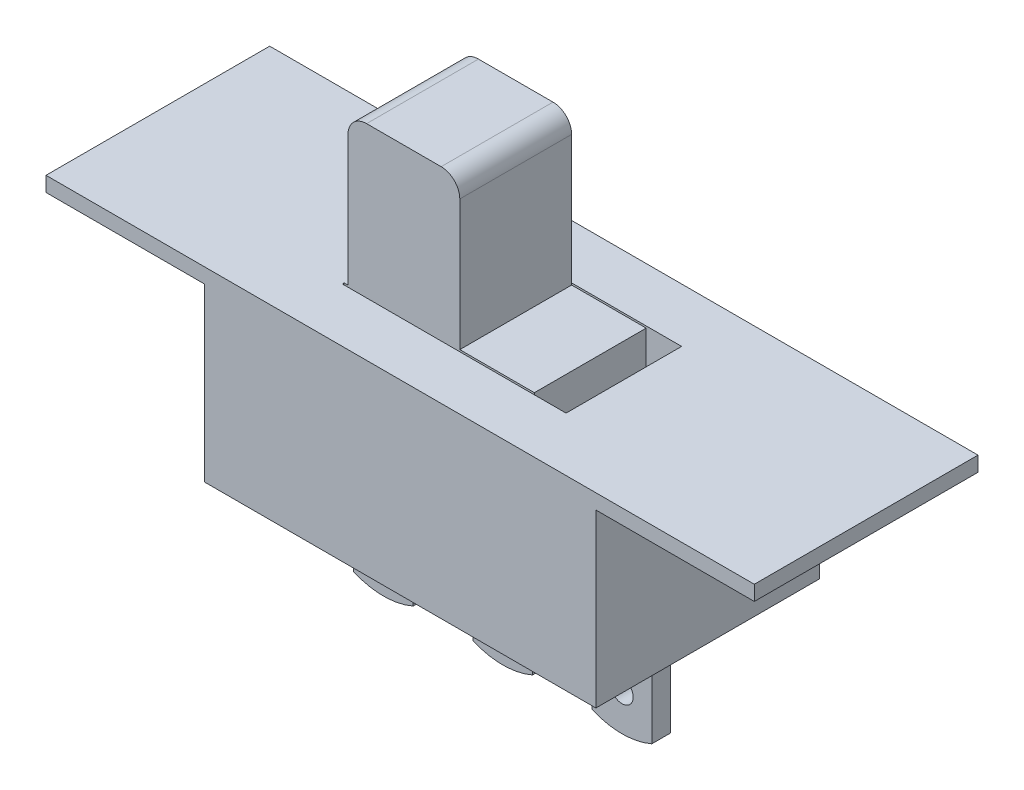
from build123d import *

# Parameters (mm, degrees)
SKETCH1_W                     = 10.5
SKETCH1_H                     = 5
BASE_DEPTH                    = 3
SKETCH2_W                     = 19
SKETCH2_H                     = 6
FLANGE_DEPTH                  = 0.4
SKETCH3_W                     = 6
SKETCH3_H                     = 3.1
SWITCH_ENCOMPASSING_CUT_DEPTH = 1
SKETCH4_W                     = 3
SKETCH4_H                     = 3
SWITCH_DEPTH                  = 5
SKETCH7_W                     = 7
SKETCH7_H                     = 3
SWITCH_BASE_DEPTH             = 1
SKETCH6_R                     = 0.3
LEG_DEPTH                     = 0.25
L_LEFT_COUNT                  = 2
L_LEFT_PITCH                  = 3.2
L_RIGHT_COUNT                 = 2
L_RIGHT_PITCH                 = 3.2
S_F_R                         = 0.5


with BuildPart() as part:
    # Sketch1 → BASE (new, symmetric)
    with BuildSketch(Plane.XY):
        with Locations((0, 2.5)):
            Rectangle(SKETCH1_W, SKETCH1_H)
    extrude(amount=BASE_DEPTH, both=True)

    # Sketch2 → FLANGE (add)
    with BuildSketch(Plane(origin=(0, 5, 0), x_dir=(1, 0, 0), z_dir=(0, 1, 0))):
        Rectangle(SKETCH2_W, SKETCH2_H)
    extrude(amount=-FLANGE_DEPTH)

    # Sketch3 → SWITCH ENCOMPASSING CUT (cut)
    with BuildSketch(Plane(origin=(0, 5, 0), x_dir=(1, 0, 0), z_dir=(0, 1, 0))):
        Rectangle(SKETCH3_W, SKETCH3_H)
    extrude(amount=-SWITCH_ENCOMPASSING_CUT_DEPTH, mode=Mode.SUBTRACT)

    # Sketch4 → SWITCH (add)
    with BuildSketch(Plane(origin=(0, 4, 0), x_dir=(1, 0, 0), z_dir=(0, 1, 0))):
        with Locations((-1.4, 0)):
            Rectangle(SKETCH4_W, SKETCH4_H)
    extrude(amount=SWITCH_DEPTH)

    # Sketch7 → SWITCH BASE (add)
    with BuildSketch(Plane(origin=(0, 5, 0), x_dir=(1, 0, 0), z_dir=(0, 1, 0))):
        with Locations((-1.4, 0)):
            Rectangle(SKETCH7_W, SKETCH7_H)
    extrude(amount=-SWITCH_BASE_DEPTH)

    # Sketch6 → LEG (add, symmetric)
    with BuildSketch(Plane.XY):
        with BuildLine():
            Line((-0.8, 0), (0.8, 0))
            Line((0.8, 0), (0.8, -2.833030278))
            ThreePointArc((0.8, -2.833030278), (0, -3), (-0.8, -2.833030278))
            Line((-0.8, -2.833030278), (-0.8, 0))
        make_face()
        with Locations((0, -2)):
            Circle(SKETCH6_R, mode=Mode.SUBTRACT)
    leg = extrude(amount=LEG_DEPTH, both=True)

    # L LEFT: LEG ×2
    with Locations(*[(i * L_LEFT_PITCH, 0, 0) for i in range(1, L_LEFT_COUNT)]):
        add(leg)

    # L RIGHT: LEG ×2
    with Locations(*[(-i * L_RIGHT_PITCH, 0, 0) for i in range(1, L_RIGHT_COUNT)]):
        add(leg)

    # S F
    s_f_edges = [part.edges().sort_by_distance(p)[0] for p in [
        (-2.9, 9, 0),
        (0.1, 9, 0),
    ]]
    fillet(s_f_edges, radius=S_F_R)


solid = part.part
